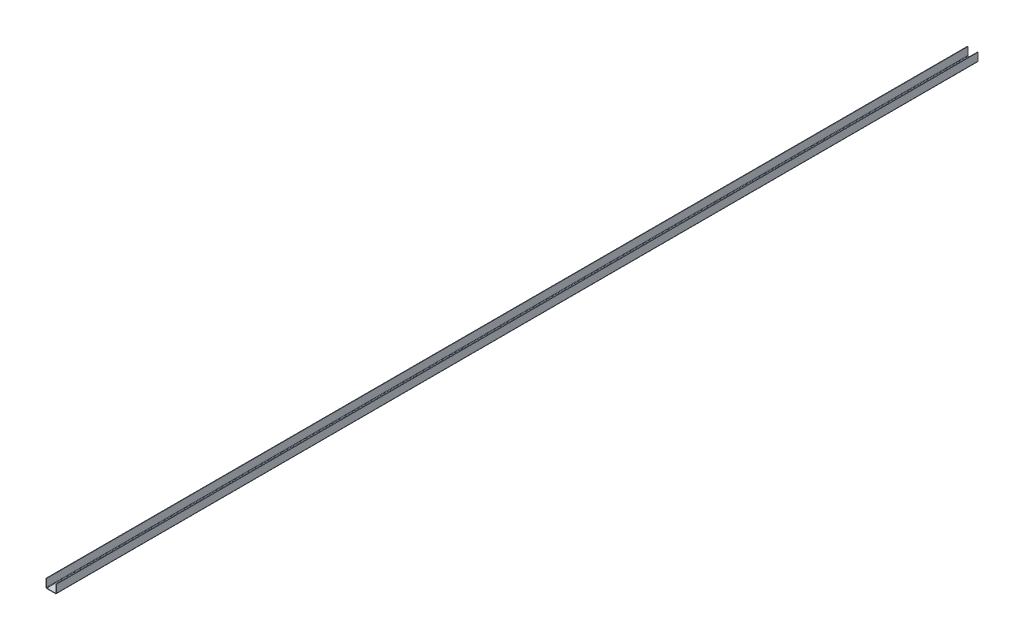
from build123d import *

# Parameters (mm, degrees)
EXTRUDE_THIN1_DEPTH = 2997
SKETCH2_R           = 3.25
CUT_EXTRUDE1_DEPTH  = 2998.203367213
LPATTERN1_COUNT     = 3
LPATTERN1_PITCH     = 1000


with BuildPart() as part:
    # Sketch1 → Extrude-Thin1 (new body)
    with BuildSketch(Plane.XY):
        with BuildLine():
            Line((11.267326733, 18.158415842), (11.267326733, -6.841584158))
            ThreePointArc((11.267326733, -6.841584158), (10.388647076, -8.962904502), (8.267326733, -9.841584158))
            Line((8.267326733, -9.841584158), (-19.732673267, -9.841584158))
            ThreePointArc((-19.732673267, -9.841584158), (-21.853993611, -8.962904502), (-22.732673267, -6.841584158))
            Line((-22.732673267, -6.841584158), (-22.732673267, 18.158415842))
            Line((-22.732673267, 18.158415842), (-21.232673267, 18.158415842))
            Line((-21.232673267, 18.158415842), (-21.232673267, -6.841584158))
            ThreePointArc((-21.232673267, -6.841584158), (-20.793333439, -7.90224433), (-19.732673267, -8.341584158))
            Line((-19.732673267, -8.341584158), (8.267326733, -8.341584158))
            ThreePointArc((8.267326733, -8.341584158), (9.327986904, -7.90224433), (9.767326733, -6.841584158))
            Line((9.767326733, -6.841584158), (9.767326733, 18.158415842))
            Line((9.767326733, 18.158415842), (11.267326733, 18.158415842))
        make_face()
    extrude(amount=EXTRUDE_THIN1_DEPTH)

    # Sketch2 → Cut-Extrude1 (cut, through all)
    with BuildSketch(Plane(origin=(0, -8.341584158, 0), x_dir=(1, 0, 0), z_dir=(0, 1, 0))):
        with Locations(Location((-5.732673267, -2498.5, 0), (0, 0, 180))):
            Circle(SKETCH2_R)
    cut_extrude1 = extrude(amount=-CUT_EXTRUDE1_DEPTH, mode=Mode.SUBTRACT)

    # LPattern1: Cut-Extrude1 ×3
    with Locations(*[(0, 0, -i * LPATTERN1_PITCH) for i in range(1, LPATTERN1_COUNT)]):
        add(cut_extrude1, mode=Mode.SUBTRACT)


solid = part.part
